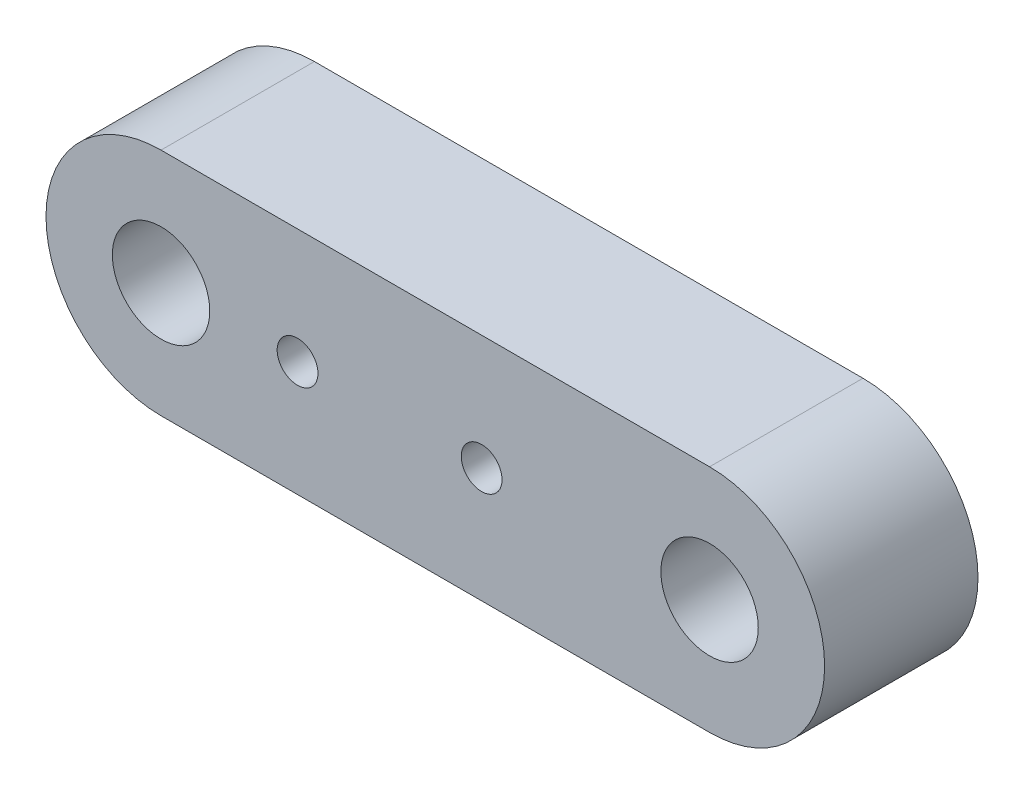
from build123d import *

# Parameters (mm, degrees)
BOSS_EXTRUDE1_DEPTH = 2.5
SKETCH2_R           = 1.5875
CUT_EXTRUDE1_DEPTH  = 15.145621231
CUT_EXTRUDE2_REACH  = 16.146
SKETCH5_R           = 0.665


with BuildPart() as part:
    # Sketch1 → Boss-Extrude1 (new, symmetric)
    with BuildSketch(Plane.XY):
        with BuildLine():
            Line((-8.94, 3.75), (8.94, 3.75))
            ThreePointArc((8.94, 3.75), (12.69, 0), (8.94, -3.75))
            Line((8.94, -3.75), (-8.94, -3.75))
            ThreePointArc((-8.94, -3.75), (-12.69, 0), (-8.94, 3.75))
        make_face()
    extrude(amount=BOSS_EXTRUDE1_DEPTH, both=True)

    # Sketch2 → Cut-Extrude1 (cut, through all)
    with BuildSketch(Plane.XY.offset(2.5)):
        with Locations((-8.94, 0)):
            Circle(SKETCH2_R)
        with Locations((8.94, 0)):
            Circle(SKETCH2_R)
    extrude(amount=-CUT_EXTRUDE1_DEPTH, mode=Mode.SUBTRACT)

    # Sketch5 → Cut-Extrude2 (cut, up to next)
    with BuildSketch(Plane.XY.offset(2.5), mode=Mode.PRIVATE) as cut_extrude2_sk1:
        with Locations((-4.49, 0)):
            Circle(SKETCH5_R)
    cut_extrude2_tool1 = extrude(cut_extrude2_sk1.sketch, amount=-CUT_EXTRUDE2_REACH, mode=Mode.PRIVATE) & part.part
    # Sketch5 → Cut-Extrude2 (cut, up to next)
    with BuildSketch(Plane.XY.offset(2.5), mode=Mode.PRIVATE) as cut_extrude2_sk2:
        with Locations((1.51, 0)):
            Circle(SKETCH5_R)
    cut_extrude2_tool2 = extrude(cut_extrude2_sk2.sketch, amount=-CUT_EXTRUDE2_REACH, mode=Mode.PRIVATE) & part.part
    add(cut_extrude2_tool1.solids().sort_by_distance((-4.49, 0, 2.5))[0], mode=Mode.SUBTRACT)
    add(cut_extrude2_tool2.solids().sort_by_distance((1.51, 0, 2.5))[0], mode=Mode.SUBTRACT)


solid = part.part
